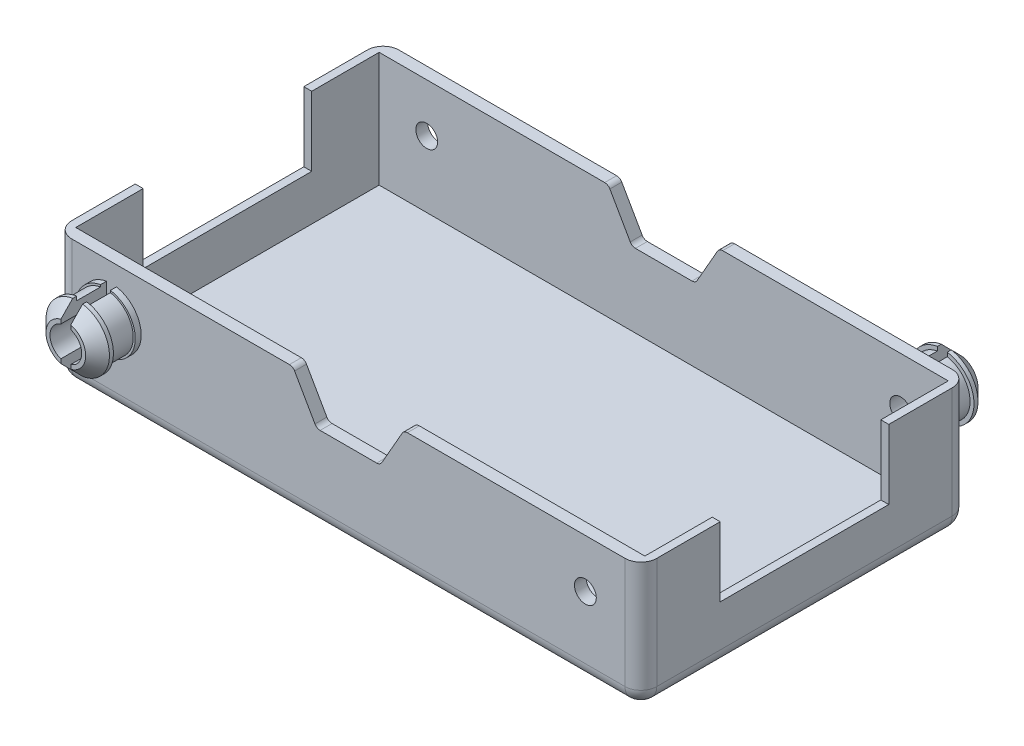
from build123d import *

# Parameters (mm, degrees)
SKETCH1_W                                    = 147.5
SKETCH1_H                                    = 82.5
BOSS_EXTRUDE1_DEPTH                          = 32
SHELL1_T                                     = -3
FILLET1_R                                    = 4
CUT_EXTRUDE1_START                           = -1
SKETCH4_W                                    = 76.5
SKETCH4_H                                    = 29
CUT_EXTRUDE1_DEPTH                           = 143.5
CUT_EXTRUDE2_REACH                           = 174.007
SKETCH5_W                                    = 42.5
SKETCH5_H                                    = 17.5
CUT_EXTRUDE3_REACH                           = 174.007
FILLET2_R                                    = 1.5
CUT_EXTRUDE4_START                           = -82.5
SKETCH7_R                                    = 2.75
CUT_EXTRUDE4_DEPTH                           = 82.5
SKETCH9_R                                    = 7.5
SKETCH9_R_2                                  = 2.75
BOSS_EXTRUDE3_DEPTH                          = 1.5
CUT_EXTRUDE5_REACH                           = 174.007
SKETCH11_W                                   = 2.5
SKETCH11_H                                   = 16
MIRROR2_AT_THE_SECOND_PLANE_COPY_1_SKETC_R   = 7.5
MIRROR2_AT_THE_SECOND_PLANE_COPY_1_SKETC_R_2 = 2.75
MIRROR2_AT_THE_SECOND_PLANE_COPY_1_DEPTH     = 1.5
MIRROR2_AT_THE_SECOND_PLANE_COPY_3_REACH     = 174.007
MIRROR2_AT_THE_SECOND_PLANE_COPY_3_SKETC_W   = 2.5
MIRROR2_AT_THE_SECOND_PLANE_COPY_3_SKETC_H   = 16
SKETCH12_W                                   = 25.238507428
SKETCH12_H                                   = 22.458767107
CUT_EXTRUDE6_DEPTH                           = 11.5
CUT_EXTRUDE7_REACH                           = 179.81
SKETCH13_W                                   = 81.509123874
SKETCH13_H                                   = 19.339493898


with BuildPart() as part:
    # Sketch1 → Boss-Extrude1 (new body)
    with BuildSketch(Plane(origin=(0, 0, 0), x_dir=(1, 0, 0), z_dir=(0, 1, 0))):
        with Locations((73.75, 41.25)):
            Rectangle(SKETCH1_W, SKETCH1_H)
    extrude(amount=BOSS_EXTRUDE1_DEPTH)

    # Shell1
    shell1_openings = [part.faces().sort_by_distance(p)[0] for p in [
        (73.75, 32, -41.25),
    ]]
    offset(amount=SHELL1_T, openings=shell1_openings, kind=Kind.INTERSECTION)

    # Fillet1
    fillet1_edges = [part.edges().sort_by_distance(p)[0] for p in [
        (73.75, 0, -82.5),
        (147.5, 0, -41.25),
        (73.75, 0, 0),
        (0, 0, -41.25),
        (0, 16, -82.5),
        (147.5, 16, -82.5),
        (147.5, 16, 0),
        (0, 16, 0),
    ]]
    fillet(fillet1_edges, radius=FILLET1_R)

    # Sketch4 → Cut-Extrude1 (cut)
    with BuildSketch(Plane(origin=(3, 0, 0), x_dir=(0, 0, -1), z_dir=(1, 0, 0)).offset(CUT_EXTRUDE1_START)):
        with Locations((41.25, 17.5)):
            Rectangle(SKETCH4_W, SKETCH4_H)
    extrude(amount=CUT_EXTRUDE1_DEPTH, mode=Mode.SUBTRACT)

    # Cut-Extrude2: up to this face of the body (flat: up to its plane)
    cut_extrude2_end = Plane(part.part.faces().sort_by_distance((0, 18, -41.25))[0])
    # Sketch5 → Cut-Extrude2 (cut, up to the picked face)
    with BuildSketch(Plane(origin=(147.5, 0, 0), x_dir=(0, 0, -1), z_dir=(1, 0, 0)), mode=Mode.PRIVATE) as cut_extrude2_sk1:
        with Locations((41.25, 23.25)):
            Rectangle(SKETCH5_W, SKETCH5_H)
    cut_extrude2_tool1 = split(extrude(cut_extrude2_sk1.sketch, amount=-CUT_EXTRUDE2_REACH, mode=Mode.PRIVATE), bisect_by=cut_extrude2_end, keep=Keep.BOTH, mode=Mode.PRIVATE)
    add(cut_extrude2_tool1.solids().sort_by(Axis((147.5, 23.25, -41.25), (-1, 0, 0)))[0], mode=Mode.SUBTRACT)

    # Cut-Extrude3: up to this face of the body (flat: up to its plane)
    cut_extrude3_end = Plane(part.part.faces().sort_by_distance((73.75, 18, -82.5))[0])
    # Sketch6 → Cut-Extrude3 (cut, up to the picked face)
    with BuildSketch(Plane.XY, mode=Mode.PRIVATE) as cut_extrude3_sk1:
        Polygon((65.75, 21.5), (81.75, 21.5), (87.75, 32), (59.75, 32), align=None)
    cut_extrude3_tool1 = split(extrude(cut_extrude3_sk1.sketch, amount=-CUT_EXTRUDE3_REACH, mode=Mode.PRIVATE), bisect_by=cut_extrude3_end, keep=Keep.BOTH, mode=Mode.PRIVATE)
    add(cut_extrude3_tool1.solids().sort_by(Axis((73.75, 27.227273, 0), (0, 0, -1)))[0], mode=Mode.SUBTRACT)

    # Fillet2
    fillet2_edges = [part.edges().sort_by_distance(p)[0] for p in [
        (65.75, 21.5, -1.5),
        (59.75, 32, -1.5),
        (87.75, 32, -1.5),
        (81.75, 21.5, -1.5),
        (65.75, 21.5, -81),
        (59.75, 32, -81),
        (87.75, 32, -81),
        (81.75, 21.5, -81),
    ]]
    fillet(fillet2_edges, radius=FILLET2_R)

    # Sketch7 → Cut-Extrude4 (cut)
    with BuildSketch(Plane.XY.offset(CUT_EXTRUDE4_START)):
        with Locations((14, 19.75)):
            Circle(SKETCH7_R)
        with Locations((133.5, 19.75)):
            Circle(SKETCH7_R)
    extrude(amount=CUT_EXTRUDE4_DEPTH, mode=Mode.SUBTRACT)

    # Sketch9 → Boss-Extrude3 (add)
    with BuildSketch(Plane.XY):
        with Locations(Location((14, 19.75, 0), (0, 0, 180))):
            Circle(SKETCH9_R)
        with Locations((14, 19.75)):
            Circle(SKETCH9_R_2, mode=Mode.SUBTRACT)
    boss_extrude3 = extrude(amount=BOSS_EXTRUDE3_DEPTH)

    # Sketch10 → Revolve1 (revolve)
    with BuildSketch(Plane.ZY.offset(-14), mode=Mode.PRIVATE) as revolve1_sk:
        Polygon((11.5, 24.75), (8.5, 27.75), (7.5, 27.75), (7.5, 26.75), (1.5, 26.75), (1.5, 23.75), (11.5, 23.75), align=None)
    revolve1 = revolve(revolve1_sk.sketch.rotate(Axis((14, 19.75, 0), (0, 0, 1)), 90), axis=Axis((14, 19.75, 0), (0, 0, 1)))

    # Cut-Extrude5: up to this face of the body (flat: up to its plane)
    cut_extrude5_end = Plane(part.part.faces().sort_by_distance((18.141421356, 19.75, 11.5))[0])
    # Sketch11 → Cut-Extrude5 (cut, up to the picked face)
    with BuildSketch(Plane.XY, mode=Mode.PRIVATE) as cut_extrude5_sk1:
        with Locations((14, 19.75)):
            Rectangle(SKETCH11_W, SKETCH11_H)
    cut_extrude5_tool1 = split(extrude(cut_extrude5_sk1.sketch, amount=CUT_EXTRUDE5_REACH, mode=Mode.PRIVATE), bisect_by=cut_extrude5_end, keep=Keep.BOTH, mode=Mode.PRIVATE)
    cut_extrude5 = cut_extrude5_tool1.solids().sort_by(Axis((14, 19.75, 0), (0, 0, 1)))[0]
    add(cut_extrude5, mode=Mode.SUBTRACT)

    # Mirror2: Boss-Extrude3, Revolve1, Cut-Extrude5 across plane
    add(boss_extrude3.mirror(Plane.ZY.offset(-73.75)))
    add(revolve1.mirror(Plane.ZY.offset(-73.75)))
    add(cut_extrude5.mirror(Plane.ZY.offset(-73.75)), mode=Mode.SUBTRACT)

    # Mirror2 at the second plane: Boss-Extrude3, Revolve1, Cut-Extrude5 across plane
    add(boss_extrude3.mirror(Plane.XY.offset(-41.25)))
    add(revolve1.mirror(Plane.XY.offset(-41.25)))
    add(cut_extrude5.mirror(Plane.XY.offset(-41.25)), mode=Mode.SUBTRACT)

    # Mirror2 at the second plane copy 1 sketc → Mirror2 at the second plane copy 1 (add)
    with BuildSketch(Plane(origin=(147.5, 0, -82.5), x_dir=(-1, 0, 0), z_dir=(0, 0, -1))):
        with Locations(Location((14, 19.75, 0), (0, 0, 180))):
            Circle(MIRROR2_AT_THE_SECOND_PLANE_COPY_1_SKETC_R)
        with Locations((14, 19.75)):
            Circle(MIRROR2_AT_THE_SECOND_PLANE_COPY_1_SKETC_R_2, mode=Mode.SUBTRACT)
    extrude(amount=MIRROR2_AT_THE_SECOND_PLANE_COPY_1_DEPTH)

    # Mirror2 at the second plane copy 2 sketc → Mirror2 at the second plane copy 2 (revolve)
    with BuildSketch(Plane(origin=(133.5, 0, -82.5), x_dir=(0, 0, -1), z_dir=(1, 0, 0))):
        Polygon((11.5, 24.75), (8.5, 27.75), (7.5, 27.75), (7.5, 26.75), (1.5, 26.75), (1.5, 23.75), (11.5, 23.75), align=None)
    revolve(axis=Axis((133.5, 19.75, -82.5), (0, 0, -1)))

    # Mirror2 at the second plane copy 3: up to this face of the body (flat: up to its plane)
    mirror2_at_the_second_plane_copy_3_end = Plane(part.part.faces().sort_by_distance((129.358578644, 19.75, -94))[0])
    # Mirror2 at the second plane copy 3 sketc → Mirror2 at the second plane copy 3 (cut, up to the picked face)
    with BuildSketch(Plane(origin=(147.5, 0, -82.5), x_dir=(-1, 0, 0), z_dir=(0, 0, -1)), mode=Mode.PRIVATE) as mirror2_at_the_second_plane_copy_3_sk1:
        with Locations((14, 19.75)):
            Rectangle(MIRROR2_AT_THE_SECOND_PLANE_COPY_3_SKETC_W, MIRROR2_AT_THE_SECOND_PLANE_COPY_3_SKETC_H)
    mirror2_at_the_second_plane_copy_3_tool1 = split(extrude(mirror2_at_the_second_plane_copy_3_sk1.sketch, amount=MIRROR2_AT_THE_SECOND_PLANE_COPY_3_REACH, mode=Mode.PRIVATE), bisect_by=mirror2_at_the_second_plane_copy_3_end, keep=Keep.BOTH, mode=Mode.PRIVATE)
    add(mirror2_at_the_second_plane_copy_3_tool1.solids().sort_by(Axis((133.5, 19.75, -82.5), (0, 0, -1)))[0], mode=Mode.SUBTRACT)

    # Sketch12 → Cut-Extrude6 (cut)
    with BuildSketch(Plane(origin=(0, 0, -82.5), x_dir=(-1, 0, 0), z_dir=(0, 0, -1))):
        with Locations((-16.619253714, 19.183530238)):
            Rectangle(SKETCH12_W, SKETCH12_H)
    extrude(amount=CUT_EXTRUDE6_DEPTH, mode=Mode.SUBTRACT)

    # Sketch13 → Cut-Extrude7 (cut, up to next)
    with BuildSketch(Plane.XY, mode=Mode.PRIVATE) as cut_extrude7_sk1:
        with Locations((102.745438063, 20.1193122)):
            Rectangle(SKETCH13_W, SKETCH13_H)
    cut_extrude7_tool1 = extrude(cut_extrude7_sk1.sketch, amount=CUT_EXTRUDE7_REACH, mode=Mode.PRIVATE) & part.part
    add(cut_extrude7_tool1.solids().sort_by_distance((102.745438, 20.119312, 0))[0], mode=Mode.SUBTRACT)
    add(cut_extrude7_tool1.solids().sort_by_distance((102.745438, 20.119312, 0))[1], mode=Mode.SUBTRACT)


solid = part.part
